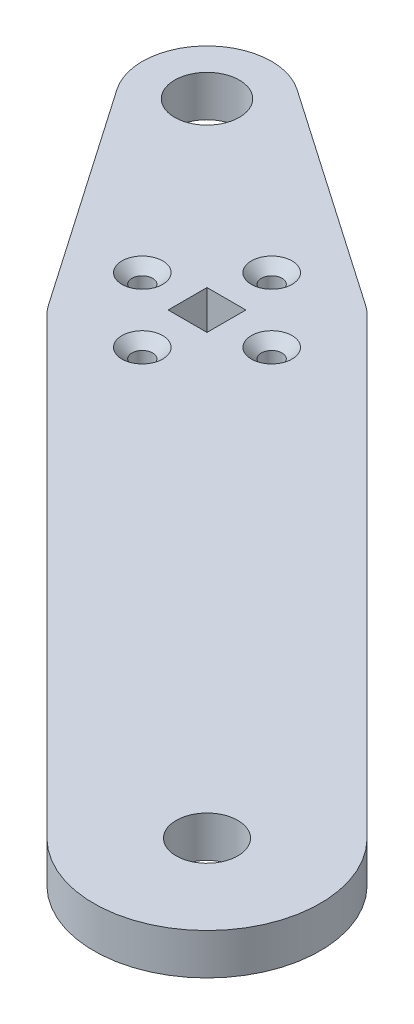
from build123d import *

# Parameters (mm, degrees)
SKETCH2_R                                       = 4.7625
SKETCH2_W                                       = 6.01
SKETCH2_H                                       = 6.01
SKETCH2_R_2                                     = 5
BOSS_EXTRUDE1_DEPTH                             = 6.35
CSK_FOR_M3_FLAT_HEAD_MACHINE_SCREW1_D           = 3.2
CSK_FOR_M3_FLAT_HEAD_MACHINE_SCREW1_CSINK_D     = 6.3
CSK_FOR_M3_FLAT_HEAD_MACHINE_SCREW1_CSINK_ANGLE = 90
FILLET1_R                                       = 10


with BuildPart() as part:
    # Sketch2 → Boss-Extrude1 (new body)
    with BuildSketch(Plane(origin=(0, 0, 0), x_dir=(1, 0, 0), z_dir=(0, 1, 0))):
        with BuildLine():
            Line((83.085046789, -58.336309448), (12.374368671, 12.374368671))
            Line((12.374368671, 12.374368671), (-22.604233169, 36.514530504))
            ThreePointArc((-22.604233169, 36.514530504), (-35.355339059, 35.355339059), (-36.514530504, 22.604233169))
            Line((-36.514530504, 22.604233169), (-12.374368671, -12.374368671))
            Line((-12.374368671, -12.374368671), (58.336309448, -83.085046789))
            ThreePointArc((58.336309448, -83.085046789), (83.085046789, -83.085046789), (83.085046789, -58.336309448))
        make_face()
        with Locations((70.710678119, -70.710678119)):
            Circle(SKETCH2_R, mode=Mode.SUBTRACT)
        Rectangle(SKETCH2_W, SKETCH2_H, mode=Mode.SUBTRACT)
        with Locations((-28.284271247, 28.284271247)):
            Circle(SKETCH2_R_2, mode=Mode.SUBTRACT)
    extrude(amount=-BOSS_EXTRUDE1_DEPTH)

    # CSK for M3 Flat Head Machine Screw1 (through all)
    with Locations(Plane(origin=(0, 0, -10), x_dir=(0, 0, 1), z_dir=(0, 1, 0))):
        with Locations((0, 0), (10, -10), (10, 10), (20, 0)):
            CounterSinkHole(CSK_FOR_M3_FLAT_HEAD_MACHINE_SCREW1_D / 2, CSK_FOR_M3_FLAT_HEAD_MACHINE_SCREW1_CSINK_D / 2, counter_sink_angle=CSK_FOR_M3_FLAT_HEAD_MACHINE_SCREW1_CSINK_ANGLE)

    # Fillet1
    fillet1_edges = [part.edges().sort_by_distance(p)[0] for p in [
        (12.374368671, -3.175, -12.374368671),
        (-12.374368671, -3.175, 12.374368671),
    ]]
    fillet(fillet1_edges, radius=FILLET1_R)


solid = part.part
